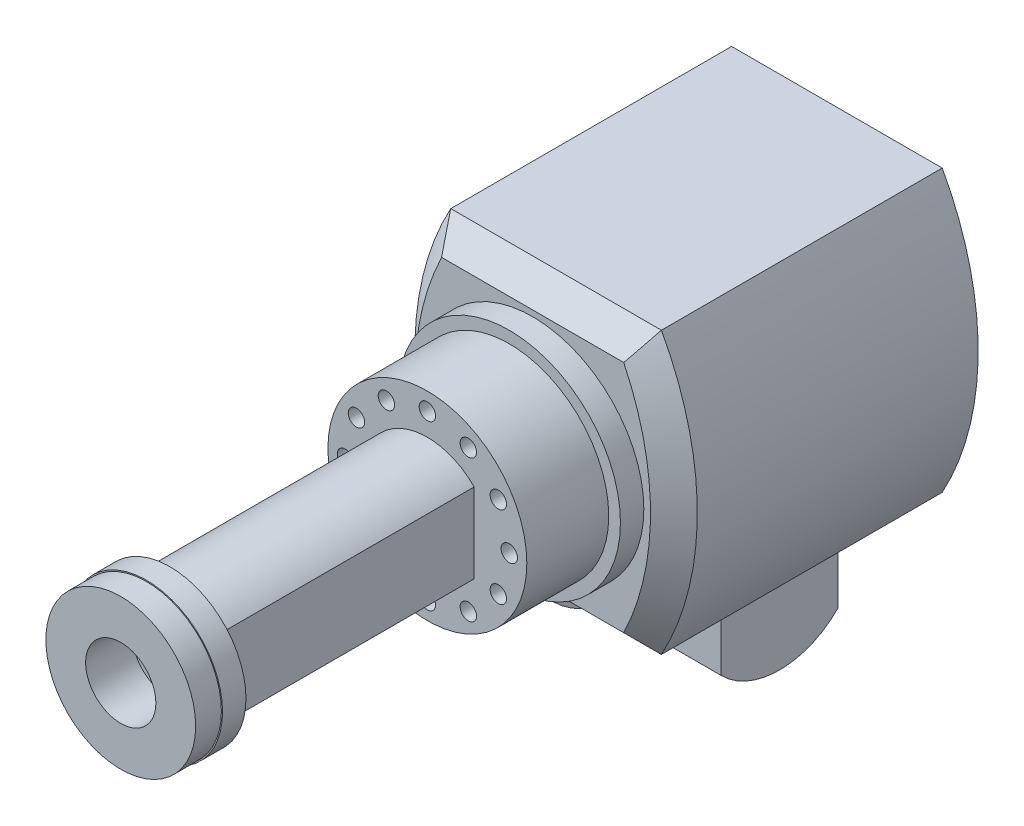
from build123d import *

# Parameters (mm, degrees)
BOSS_EXTRUDE1_DEPTH  = 120
BOSS_EXTRUDE2_DEPTH  = 10
BOSS_EXTRUDE2_TAPER  = 45
SKETCH3_R            = 47.5
BOSS_EXTRUDE3_DEPTH  = 10
SKETCH4_R            = 42.5
BOSS_EXTRUDE4_DEPTH  = 35
SKETCH5_R            = 3.5
CUT_EXTRUDE1_DEPTH   = 10
BOSS_EXTRUDE5_DEPTH  = 110
SKETCH7_R            = 32.5
BOSS_EXTRUDE6_DEPTH  = 10
SKETCH8_R            = 32
BOSS_EXTRUDE7_DEPTH  = 11
SKETCH10_R           = 45
BOSS_EXTRUDE9_DEPTH  = 15.5
BOSS_EXTRUDE10_DEPTH = 65
SKETCH12_R           = 15
CUT_EXTRUDE2_DEPTH   = 20
SKETCH13_R           = 17.5
CUT_EXTRUDE3_DEPTH   = 22


with BuildPart() as part:
    # Sketch1 → Boss-Extrude1 (new body)
    with BuildSketch(Plane.XY):
        with BuildLine():
            Line((45, 60), (-45, 60))
            ThreePointArc((-45, 60), (-60.341439003, 0), (-45, -60))
            Line((-45, -60), (45, -60))
            ThreePointArc((45, -60), (60.341439003, 0), (45, 60))
        make_face()
    extrude(amount=BOSS_EXTRUDE1_DEPTH)

    # Sketch2 → Boss-Extrude2 (add)
    with BuildSketch(Plane.XY.offset(120)):
        with BuildLine():
            Line((45, 60), (-45, 60))
            ThreePointArc((-45, 60), (-60.341439003, 0), (-45, -60))
            Line((-45, -60), (45, -60))
            ThreePointArc((45, -60), (60.341439003, 0), (45, 60))
        make_face()
    extrude(amount=BOSS_EXTRUDE2_DEPTH, taper=BOSS_EXTRUDE2_TAPER)

    # Sketch3 → Boss-Extrude3 (add)
    with BuildSketch(Plane.XY.offset(130)):
        Circle(SKETCH3_R)
    extrude(amount=BOSS_EXTRUDE3_DEPTH)

    # Sketch4 → Boss-Extrude4 (add)
    with BuildSketch(Plane.XY.offset(140)):
        Circle(SKETCH4_R)
    extrude(amount=BOSS_EXTRUDE4_DEPTH)

    # Sketch5 → Cut-Extrude1 (cut)
    with BuildSketch(Plane.XY.offset(175)):
        with Locations((35, 0)):
            Circle(SKETCH5_R)
        with Locations(Location((0, 35, 0), (0, 0, 180))):
            Circle(SKETCH5_R)
        with Locations((30.310889132, 17.5)):
            Circle(SKETCH5_R)
        with Locations(Location((17.5, 30.310889132, 0), (0, 0, 180))):
            Circle(SKETCH5_R)
        with Locations(Location((30.310889132, -17.5, 0), (0, 0, 180))):
            Circle(SKETCH5_R)
        with Locations((17.5, -30.310889132)):
            Circle(SKETCH5_R)
        with Locations((0, -35)):
            Circle(SKETCH5_R)
        with Locations(Location((-17.5, -30.310889132, 0), (0, 0, 180))):
            Circle(SKETCH5_R)
        with Locations((-30.310889132, -17.5)):
            Circle(SKETCH5_R)
        with Locations(Location((-35, 0, 0), (0, 0, 180))):
            Circle(SKETCH5_R)
        with Locations(Location((-30.310889132, 17.5, 0), (0, 0, 180))):
            Circle(SKETCH5_R)
        with Locations((-17.5, 30.310889132)):
            Circle(SKETCH5_R)
    extrude(amount=-CUT_EXTRUDE1_DEPTH, mode=Mode.SUBTRACT)

    # Sketch6 → Boss-Extrude5 (add)
    with BuildSketch(Plane.XY.offset(175)):
        with BuildLine():
            Line((-20, -17), (-20, 17))
            ThreePointArc((-20, 17), (0, 25.404082058), (20, 17))
            Line((20, 17), (20, -17))
            ThreePointArc((20, -17), (0, -25.404082058), (-20, -17))
        make_face()
    extrude(amount=BOSS_EXTRUDE5_DEPTH)

    # Sketch7 → Boss-Extrude6 (add)
    with BuildSketch(Plane.XY.offset(285)):
        Circle(SKETCH7_R)
    extrude(amount=BOSS_EXTRUDE6_DEPTH)

    # Sketch8 → Boss-Extrude7 (add)
    with BuildSketch(Plane.XY.offset(295)):
        Circle(SKETCH8_R)
    extrude(amount=BOSS_EXTRUDE7_DEPTH)

    # Sketch10 → Boss-Extrude9 (add, symmetric)
    with BuildSketch(Plane.ZY.offset(45)):
        with Locations(Location((60, -60, 0), (0, 0, 180))):
            Circle(SKETCH10_R)
    extrude(amount=BOSS_EXTRUDE9_DEPTH, both=True)

    # Sketch11 → Boss-Extrude10 (add)
    with BuildSketch(Plane(origin=(-29.5, 0, 0), x_dir=(0, 0, -1), z_dir=(1, 0, 0))):
        with BuildLine():
            Line((-85, -60), (-35, -60))
            Line((-35, -60), (-35, -90))
            ThreePointArc((-35, -90), (-60, -100.505102572), (-85, -90))
            Line((-85, -90), (-85, -60))
        make_face()
    extrude(amount=BOSS_EXTRUDE10_DEPTH)

    # Sketch12 → Cut-Extrude2 (cut)
    with BuildSketch(Plane.XY.offset(306)):
        Circle(SKETCH12_R)
    extrude(amount=-CUT_EXTRUDE2_DEPTH, mode=Mode.SUBTRACT)

    # Sketch13 → Cut-Extrude3 (cut)
    with BuildSketch(Plane.ZY.offset(60.5)):
        with Locations(Location((60, -60, 0), (0, 0, 270))):
            Circle(SKETCH13_R)
    extrude(amount=-CUT_EXTRUDE3_DEPTH, mode=Mode.SUBTRACT)


solid = part.part
